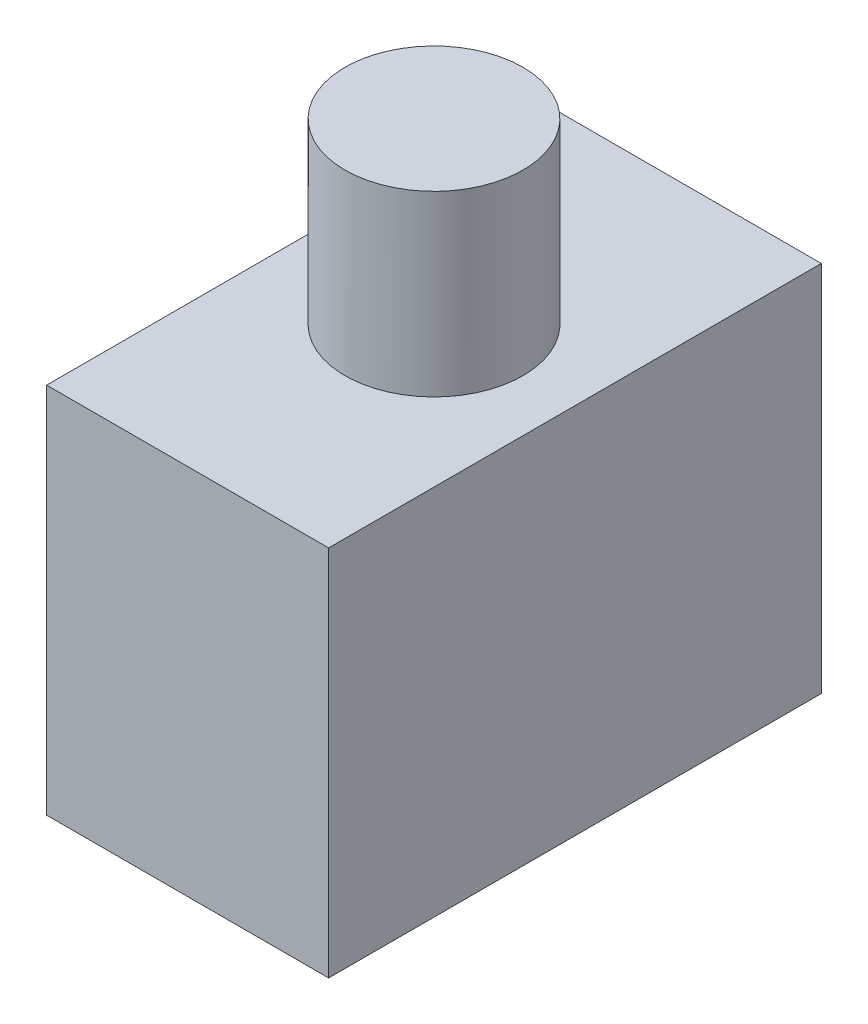
from build123d import *

# Parameters (mm, degrees)
SKETCH1_W           = 19
SKETCH1_H           = 33.2
BOSS_EXTRUDE1_DEPTH = 25.1
SKETCH2_R           = 6
BOSS_EXTRUDE2_DEPTH = 12


with BuildPart() as part:
    # Sketch1 → Boss-Extrude1 (new body)
    with BuildSketch(Plane(origin=(0, 0, 0), x_dir=(1, 0, 0), z_dir=(0, 1, 0))):
        Rectangle(SKETCH1_W, SKETCH1_H)
    extrude(amount=BOSS_EXTRUDE1_DEPTH)

    # Sketch2 → Boss-Extrude2 (add)
    with BuildSketch(Plane(origin=(0, 25.1, 0), x_dir=(-1, 0, 0), z_dir=(0, 1, 0))):
        with Locations(Location((0, 0, 0), (0, 0, 270))):
            Circle(SKETCH2_R)
    extrude(amount=BOSS_EXTRUDE2_DEPTH)


solid = part.part
